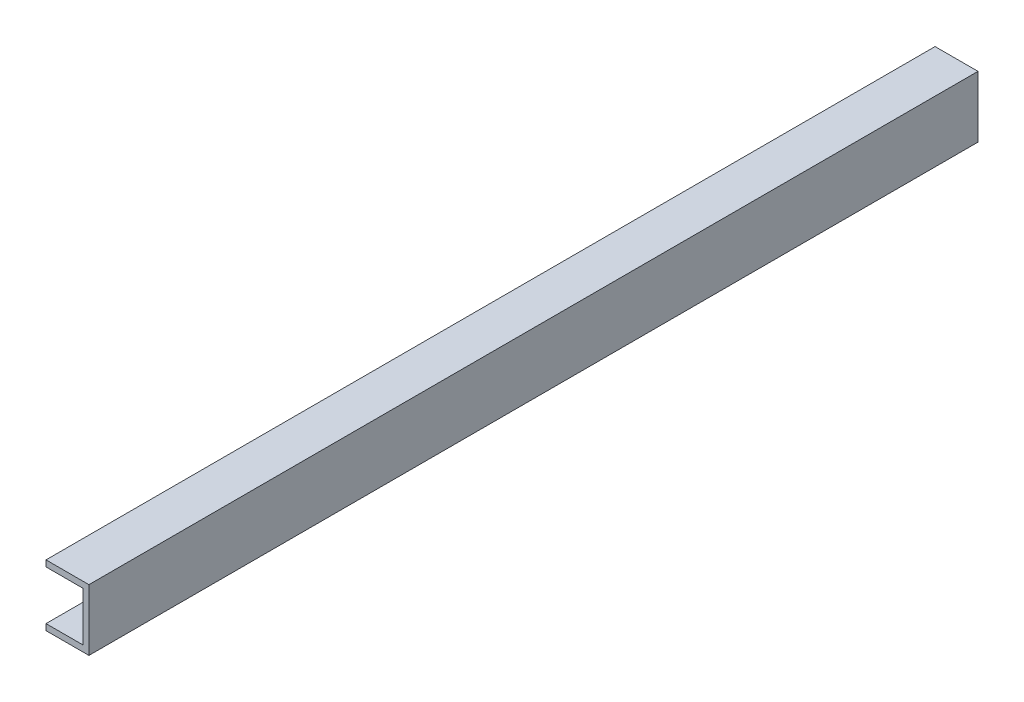
from build123d import *

# Parameters (mm, degrees)
BOSS_EXTRUDE1_DEPTH = 290


with BuildPart() as part:
    # Sketch1 → Boss-Extrude1 (new body)
    with BuildSketch(Plane.XY):
        Polygon((0, 0), (14, 0), (14, 20), (0, 20), (0, 18), (12, 18), (12, 2), (0, 2), align=None)
    extrude(amount=BOSS_EXTRUDE1_DEPTH)


solid = part.part
